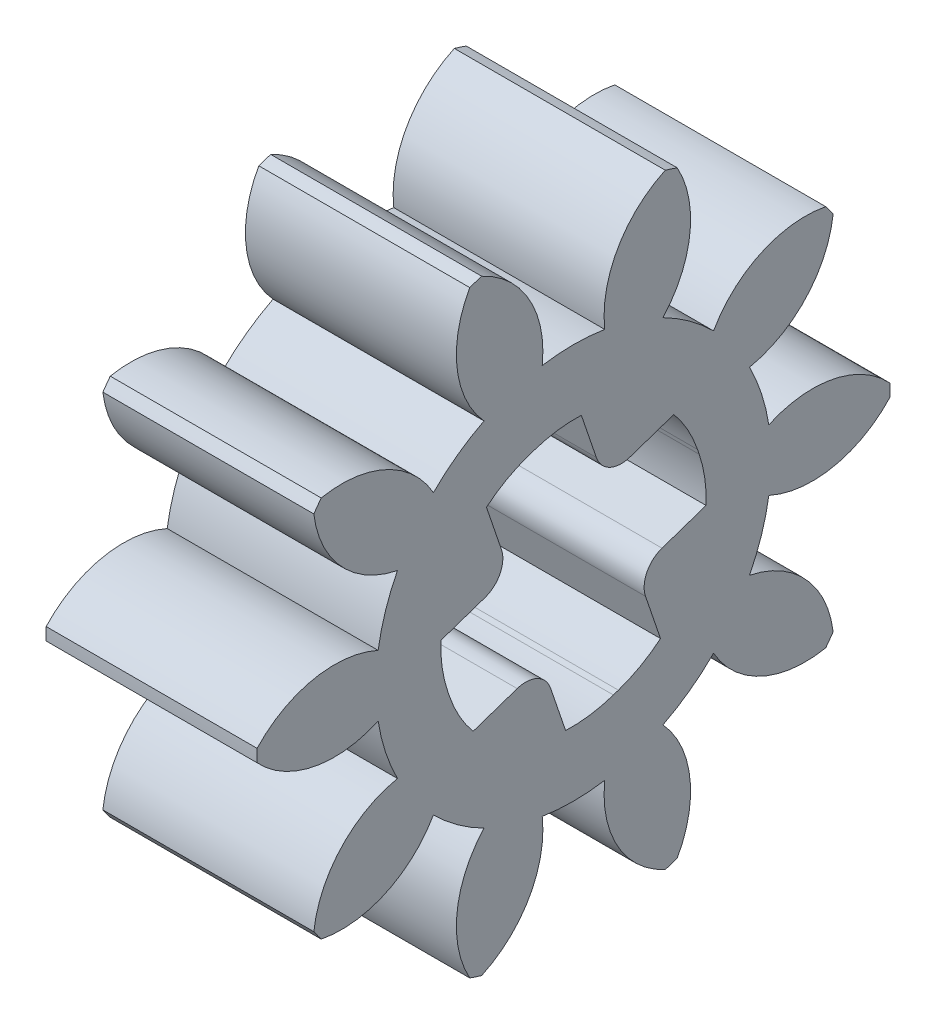
from build123d import *

# Parameters (mm, degrees)
BASPROSKE_W         = 4
BASPROSKE_H         = 6
TOOTHCUT_DEPTH      = 10.38083152
TEETHCUTS_COUNT     = 10
TEETHCUTS_ANGLE     = 324
BORSKE_R            = 2.5
BORE_DEPTH          = 50.0000508
SKETCH2_R           = 3
CUT_EXTRUDE1_DEPTH  = 10.217922092
BOSS_EXTRUDE1_START = -4
SKETCH1_R           = 3
BOSS_EXTRUDE1_DEPTH = 4


with BuildPart() as part:
    # BasProSke → Base-Revolve (revolve)
    with BuildSketch(Plane(origin=(0, 0, 0), x_dir=(1, 0, 0), z_dir=(0, 1, 0)), mode=Mode.PRIVATE) as base_revolve_sk:
        with Locations((2, 3)):
            Rectangle(BASPROSKE_W, BASPROSKE_H)
    revolve(base_revolve_sk.sketch.rotate(Axis((-10, 0, 0), (1, 0, 0)), 180), axis=Axis((-10, 0, 0), (1, 0, 0)))

    # TooCutSke → ToothCut (cut, through all)
    with BuildSketch(Plane(origin=(0, 0, 0), x_dir=(0, 0, -1), z_dir=(1, 0, 0))):
        with BuildLine():
            ThreePointArc((0.59278292, 3.701838653), (0, 3.749), (-0.59278292, 3.701838653))
            ThreePointArc((-0.59278292, 3.701838653), (-0.846593509, 4.924114224), (-1.775771316, 5.757784417))
            ThreePointArc((-1.775771316, 5.757784417), (0, 6.0254), (1.775771316, 5.757784417))
            ThreePointArc((1.775771316, 5.757784417), (0.846593509, 4.924114224), (0.59278292, 3.701838653))
        make_face()
    toothcut = extrude(amount=TOOTHCUT_DEPTH, mode=Mode.SUBTRACT)

    # TeethCuts: ToothCut ×10 about axis
    teethcuts_axis = Axis((-10, 0, 0), (1, 0, 0))
    for i in range(1, TEETHCUTS_COUNT):
        add(toothcut.rotate(teethcuts_axis, i * TEETHCUTS_ANGLE / (TEETHCUTS_COUNT - 1)), mode=Mode.SUBTRACT)

    # BorSke → Bore (cut, symmetric)
    with BuildSketch(Plane(origin=(0, 0, 0), x_dir=(0, 0, -1), z_dir=(1, 0, 0))):
        with Locations(Location((0, 0, 0), (0, 0, 180))):
            Circle(BORSKE_R)
    extrude(amount=BORE_DEPTH, both=True, mode=Mode.SUBTRACT)

    # Sketch2 → Cut-Extrude1 (cut, through all)
    with BuildSketch(Plane.ZY):
        Circle(SKETCH2_R)
    extrude(amount=-CUT_EXTRUDE1_DEPTH, mode=Mode.SUBTRACT)

    # Sketch1 → Boss-Extrude1 (add)
    with BuildSketch(Plane(origin=(4, 0, 0), x_dir=(0, 0, -1), z_dir=(1, 0, 0)).offset(BOSS_EXTRUDE1_START)):
        Circle(SKETCH1_R)
        with BuildLine():
            Line((-0.433026392, -1.678537501), (-0.149160433, -2.514010972))
            ThreePointArc((-0.149160433, -2.514010972), (0.309918975, -2.490426475), (0.756919525, -2.383185438))
            Line((0.756919525, -2.383185438), (0.851603533, -2.351014977))
            ThreePointArc((0.851603533, -2.351014977), (1.271412306, -2.163743179), (1.649835725, -1.902772209))
            Line((1.649835725, -1.902772209), (1.365969766, -1.067298739))
            ThreePointArc((1.365969766, -1.067298739), (1.390891529, -0.685427668), (1.678537501, -0.433026392))
            Line((1.678537501, -0.433026392), (2.514010972, -0.149160433))
            ThreePointArc((2.514010972, -0.149160433), (2.490426475, 0.309918975), (2.383185438, 0.756919525))
            Line((2.383185438, 0.756919525), (2.351014977, 0.851603533))
            ThreePointArc((2.351014977, 0.851603533), (2.163743179, 1.271412306), (1.902772209, 1.649835725))
            Line((1.902772209, 1.649835725), (1.067298739, 1.365969766))
            ThreePointArc((1.067298739, 1.365969766), (0.685427668, 1.390891529), (0.433026392, 1.678537501))
            Line((0.433026392, 1.678537501), (0.149160433, 2.514010972))
            ThreePointArc((0.149160433, 2.514010972), (-0.309918975, 2.490426475), (-0.756919525, 2.383185438))
            Line((-0.756919525, 2.383185438), (-0.851603533, 2.351014977))
            ThreePointArc((-0.851603533, 2.351014977), (-1.271412306, 2.163743179), (-1.649835725, 1.902772209))
            Line((-1.649835725, 1.902772209), (-1.365969766, 1.067298739))
            ThreePointArc((-1.365969766, 1.067298739), (-1.390891529, 0.685427668), (-1.678537501, 0.433026392))
            Line((-1.678537501, 0.433026392), (-2.514010972, 0.149160433))
            ThreePointArc((-2.514010972, 0.149160433), (-2.490426475, -0.309918975), (-2.383185438, -0.756919525))
            Line((-2.383185438, -0.756919525), (-2.351014977, -0.851603533))
            ThreePointArc((-2.351014977, -0.851603533), (-2.163743179, -1.271412306), (-1.902772209, -1.649835725))
            Line((-1.902772209, -1.649835725), (-1.067298739, -1.365969766))
            ThreePointArc((-1.067298739, -1.365969766), (-0.685427668, -1.390891529), (-0.433026392, -1.678537501))
        make_face(mode=Mode.SUBTRACT)
    extrude(amount=BOSS_EXTRUDE1_DEPTH)


solid = part.part
